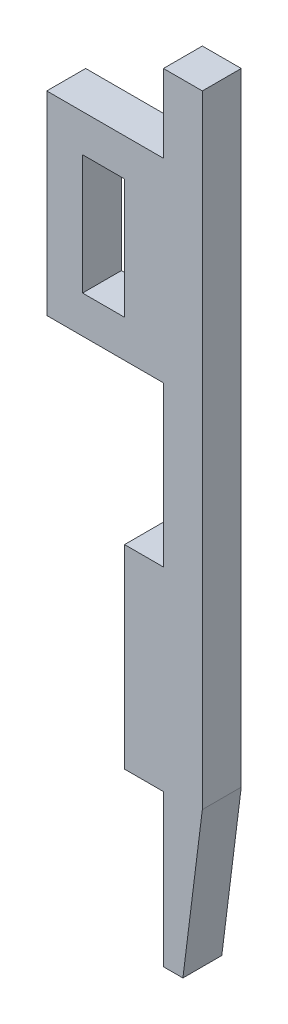
from build123d import *

# Parameters (mm, degrees)
SKETCH1_W           = 5.4
SKETCH1_H           = 15.4
SKETCH1_W_2         = 5
SKETCH1_H_2         = 15
BOSS_EXTRUDE1_DEPTH = 5
SKETCH2_W           = 10
SKETCH2_H           = 25
CUT_EXTRUDE1_DEPTH  = 10


with BuildPart() as part:
    # Sketch1 → Boss-Extrude1 (new body)
    with BuildSketch(Plane.XY):
        Polygon((0, 0), (2.5, 0), (5, 20), (5, 100), (0, 100), (0, 90), (-15, 90), (-15, 65), (0, 65), (0, 44.5), (-15, 44.5), (-15, 19.5), (0, 19.5), align=None)
        with Locations((-7.7, 77.5)):
            Rectangle(SKETCH1_W, SKETCH1_H, mode=Mode.SUBTRACT)
        with Locations((-7.5, 32)):
            Rectangle(SKETCH1_W_2, SKETCH1_H_2, mode=Mode.SUBTRACT)
    extrude(amount=BOSS_EXTRUDE1_DEPTH)

    # Sketch2 → Cut-Extrude1 (cut)
    with BuildSketch(Plane.XY.offset(5)):
        with Locations((-10, 32)):
            Rectangle(SKETCH2_W, SKETCH2_H)
    extrude(amount=-CUT_EXTRUDE1_DEPTH, mode=Mode.SUBTRACT)


solid = part.part
